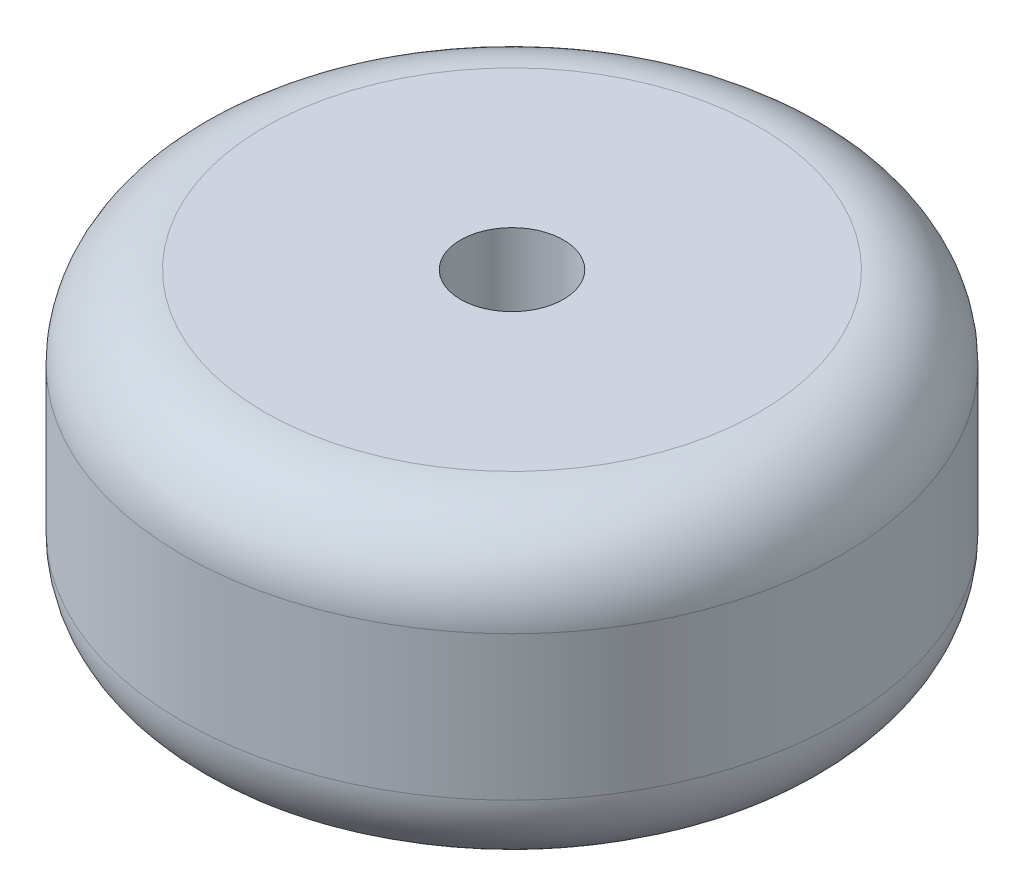
from build123d import *

# Parameters (mm, degrees)
SKETCH_1_R      = 16
SKETCH_1_R_2    = 2.5
EXTRUDE_1_DEPTH = 15
FILLET_1_R      = 4


with BuildPart() as part:
    # 草图1 → 凸台-拉伸1 (new body)
    with BuildSketch(Plane(origin=(0, 0, 0), x_dir=(1, 0, 0), z_dir=(0, 1, 0))):
        with Locations(Location((0, 0, 0), (0, 0, 270))):
            Circle(SKETCH_1_R)
        with Locations(Location((0, 0, 0), (0, 0, 270))):
            Circle(SKETCH_1_R_2, mode=Mode.SUBTRACT)
    extrude(amount=EXTRUDE_1_DEPTH)

    # 圆角1
    fillet_1_edges = [part.edges().sort_by_distance(p)[0] for p in [
        (0, 0, -16),
        (0, 15, -16),
    ]]
    fillet(fillet_1_edges, radius=FILLET_1_R)


solid = part.part
